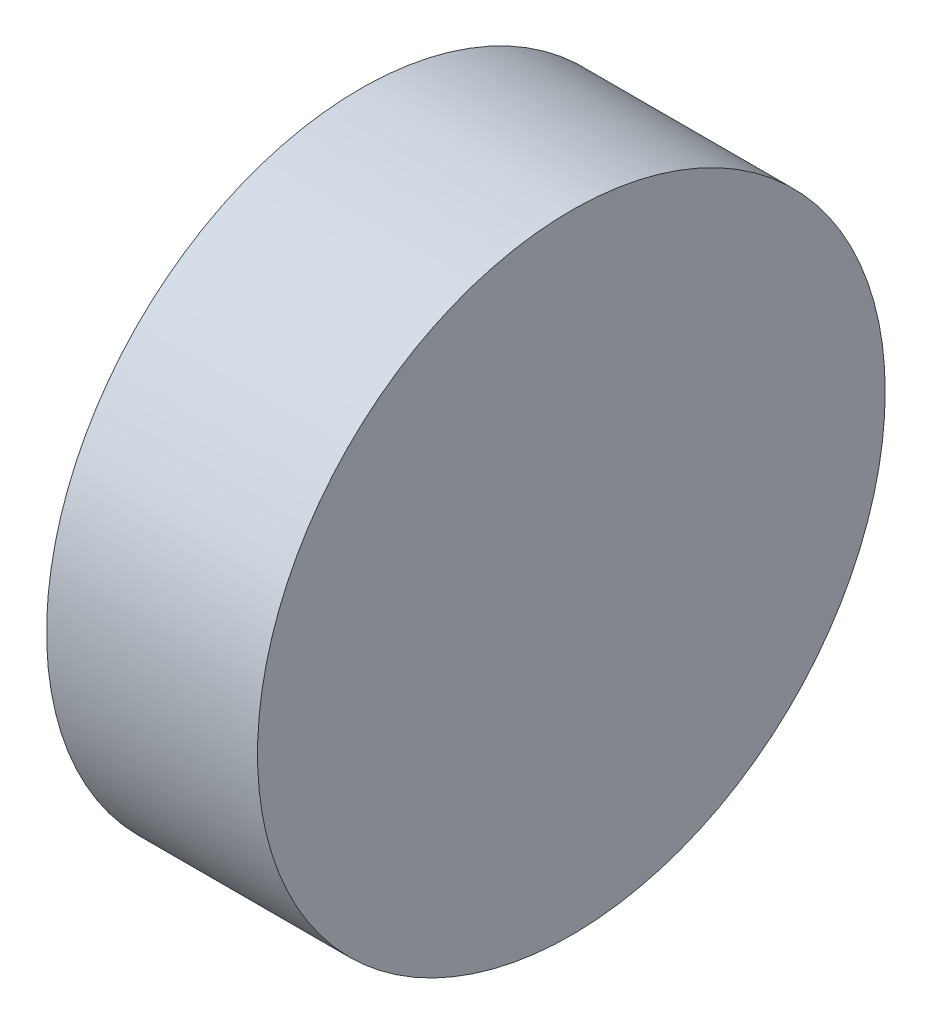
from build123d import *

# Parameters (mm, degrees)
SKETCH3_R           = 6.25
BOSS_EXTRUDE1_DEPTH = 4.2


with BuildPart() as part:
    # Sketch3 → Boss-Extrude1 (new body)
    with BuildSketch(Plane(origin=(0, 0, 0), x_dir=(0, 0, -1), z_dir=(1, 0, 0))):
        Circle(SKETCH3_R)
    extrude(amount=BOSS_EXTRUDE1_DEPTH)


solid = part.part
